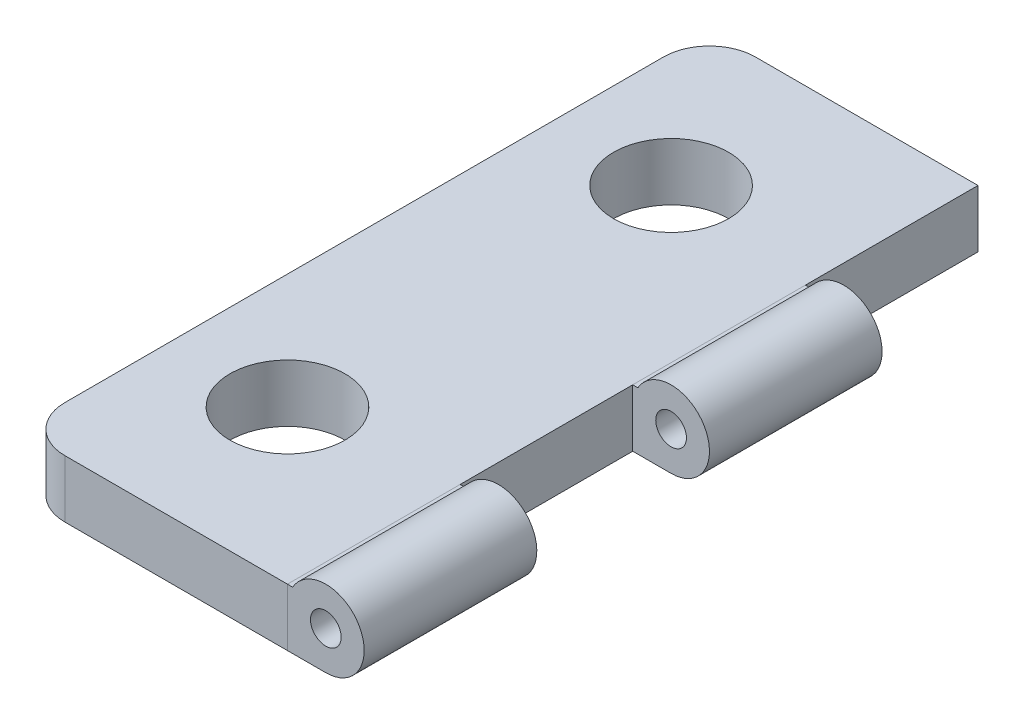
from build123d import *

# Parameters (mm, degrees)
SKETCH_1_R          = 1.5
EXTRUDE_1_DEPTH     = 1.5
SKETCH2_R           = 0.4
BOSS_EXTRUDE3_DEPTH = 18
SKETCH3_W           = 2
SKETCH3_H           = 4.5
CUT_EXTRUDE2_DEPTH  = 20


with BuildPart() as part:
    # Эскиз1 → Бобышка-Вытянуть1 (new body)
    with BuildSketch(Plane(origin=(0, 0, 0), x_dir=(1, 0, 0), z_dir=(0, 1, 0))):
        with BuildLine():
            Line((0, 16.8), (0, 1.2))
            ThreePointArc((0, 1.2), (0.351471863, 0.351471863), (1.2, 0))
            Line((1.2, 0), (7, 0))
            Line((7, 0), (7, 4.5))
            Line((7, 4.5), (7, 9))
            Line((7, 9), (7, 13.5))
            Line((7, 13.5), (7, 18))
            Line((7, 18), (1.2, 18))
            ThreePointArc((1.2, 18), (0.351471863, 17.648528137), (0, 16.8))
        make_face()
        with Locations(Location((3, 4, 0), (0, 0, 270))):
            Circle(SKETCH_1_R, mode=Mode.SUBTRACT)
        with Locations(Location((3, 14, 0), (0, 0, 270))):
            Circle(SKETCH_1_R, mode=Mode.SUBTRACT)
    extrude(amount=EXTRUDE_1_DEPTH)


with BuildPart() as body_2:
    # Sketch2 → Boss-Extrude3 (new body)
    with BuildSketch(Plane.XY):
        with BuildLine():
            Line((7, 0), (8, 0))
            ThreePointArc((8, 0), (8.866025404, 1.5), (7.133974596, 1.5))
            Line((7.133974596, 1.5), (7, 1.5))
            Line((7, 1.5), (7, 0))
        make_face()
        with Locations((8, 1)):
            Circle(SKETCH2_R, mode=Mode.SUBTRACT)
    extrude(amount=-BOSS_EXTRUDE3_DEPTH)

    # Sketch3 → Cut-Extrude2 (cut)
    with BuildSketch(Plane.XZ):
        with Locations((8, -6.75)):
            Rectangle(SKETCH3_W, SKETCH3_H)
        with Locations((8, -15.75)):
            Rectangle(SKETCH3_W, SKETCH3_H)
    extrude(amount=-CUT_EXTRUDE2_DEPTH, mode=Mode.SUBTRACT)


with BuildPart() as cut_extrude2_piece_1:
    # of the separate pieces the step leaves, piece 1, a body of its own (cut_extrude2_pieces)
    add(body_2.part.solids().sort_by_distance((8, 0, 0))[0])


with BuildPart() as cut_extrude2_piece_2:
    # of the separate pieces the step leaves, piece 2, a body of its own (cut_extrude2_pieces)
    add(body_2.part.solids().sort_by_distance((7.133974596, 1.5, -9))[0])


solid = Compound([part.part, cut_extrude2_piece_1.part, cut_extrude2_piece_2.part])
